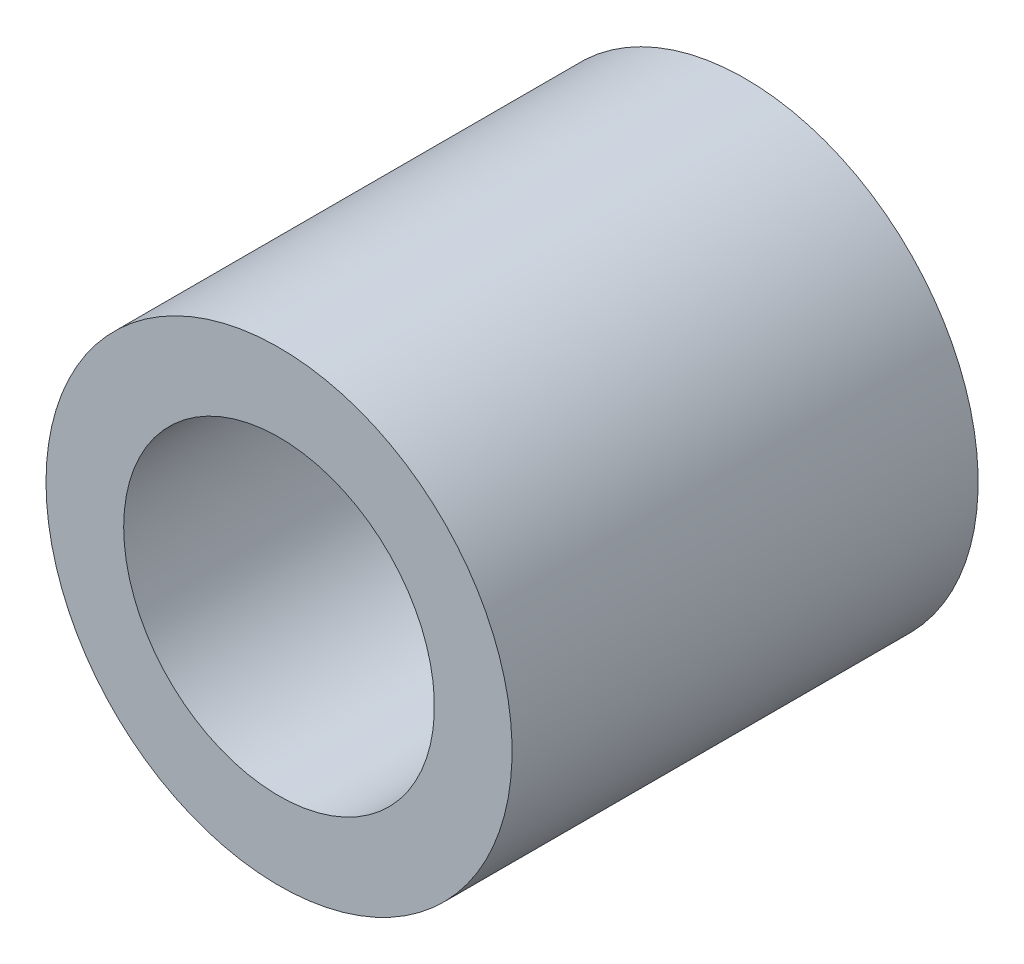
from build123d import *

# Parameters (mm, degrees)
SKETCH1_R           = 19.05
SKETCH1_R_2         = 12.7
BOSS_EXTRUDE1_DEPTH = 38.1


with BuildPart() as part:
    # Sketch1 → Boss-Extrude1 (new body)
    with BuildSketch(Plane.XY):
        with Locations(Location((0, 0, 0), (0, 0, 180))):
            Circle(SKETCH1_R)
        with Locations(Location((0, 0, 0), (0, 0, 180))):
            Circle(SKETCH1_R_2, mode=Mode.SUBTRACT)
    extrude(amount=BOSS_EXTRUDE1_DEPTH)


solid = part.part
